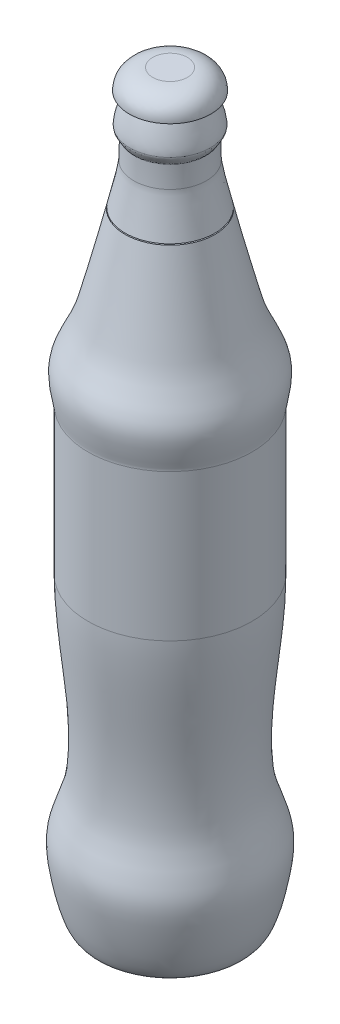
from build123d import *

# Parameters (mm, degrees)
ESBO_O4_R             = 12.021384461
CORTE_EXTRUS_O1_DEPTH = 0.1
ESBO_O5_R             = 0.5
CORTE_EXTRUS_O2_DEPTH = 0.4


with BuildPart() as part:
    # Esboço3 → Revolução1 (revolve)
    with BuildSketch(Plane.XY, mode=Mode.PRIVATE) as revolu_o1_sk:
        with BuildLine():
            Line((61.601817141, 32.402072085), (61.601817141, 47.838555424))
            add(Edge.make_bspline(
                [(61.601817141, 47.838555424), (61.601817141, 48.156811584), (60.859856314, 50.821300378), (61.77285658, 53.240312178), (62.783477222, 55.089658209), (63.874248839, 58.885612566), (66.369269293, 69.122641766), (66.419280732, 70.15583146)],
                knots=[0, 0, 0, 0, 0.186929837, 0.313357562, 0.493595799, 0.562260043, 1, 1, 1, 1], degree=3))
            add(Edge.make_bspline(
                [(66.476371283, 72.402019137), (66.476371283, 71.698138184), (66.457177975, 70.938753163), (66.419280732, 70.15583146)],
                knots=[0, 0, 0, 0, 0.075054494, 0.075054494, 0.075054494, 0.075054494], degree=3))
            add(Edge.make_bspline(
                [(65.999647343, 73.37030672), (65.999647343, 73.059092303), (66.476371283, 72.529263326), (66.476371283, 72.402019137)],
                knots=[0, 0, 0, 0, 1, 1, 1, 1], degree=3))
            add(Edge.make_bspline(
                [(65.999647343, 73.37030672), (65.999647343, 74.197074379), (66.839482035, 76.471404644)],
                knots=[0, 0, 0, 1, 1, 1], degree=2))
            Line((66.839482035, 76.471404644), (65.949262934, 76.471404644))
            add(Edge.make_bspline(
                [(68.409468023, 78.588337077), (67.155283918, 78.588337077), (65.949262934, 77.851984406), (65.949262934, 76.471404644)],
                knots=[0, 0, 0, 0, 1, 1, 1, 1], degree=3))
            Line((68.409468023, 78.588337077), (70.2369282, 78.588337077))
            Line((70.2369282, 78.588337077), (70.2369282, 0.72855248))
            Line((70.2369282, 0.72855248), (63.049496982, 0.72855248))
            add(Edge.make_bspline(
                [(63.049496982, 0.72855248), (62.280465322, 0.72855248), (61.19488738, 5.349373028), (60.838200592, 9.371029922), (62.333477371, 12.388067865), (63.179698711, 20.248645789), (61.601817141, 26.983300513), (61.601817141, 32.402072085)],
                knots=[0, 0, 0, 0, 0.184554254, 0.267801276, 0.401843949, 0.47532179, 1, 1, 1, 1], degree=3))
        make_face()
    revolve(revolu_o1_sk.sketch.rotate(Axis((70.2369282, 0.72855248, 0), (0, 1, 0)), 270), axis=Axis((70.2369282, 0.72855248, 0), (0, 1, 0)))

    # Esboço4 → Corte-extrusão1 (cut)
    with BuildSketch(Plane(origin=(0, 65.72855248, 0), x_dir=(-1, 0, 0), z_dir=(0, -1, 0))):
        with Locations((-70.2369282, 0)):
            Circle(ESBO_O4_R)
    extrude(amount=-CORTE_EXTRUS_O1_DEPTH, mode=Mode.SUBTRACT)


with BuildPart() as corte_extrus_o1_piece_1:
    # of the separate pieces the step leaves, piece 1, a body of its own (corte_extrus_o1_pieces)
    add(part.part.solids().sort_by_distance((70.2369282, 32.402072085, -8.63511106))[0])

    # Esboço5 → Corte-extrusão2 (cut)
    with BuildSketch(Plane.XZ.offset(-0.72855248)):
        with Locations(Location((70.2369282, 0, 0), (0, 0, 270))):
            Circle(ESBO_O5_R)
    extrude(amount=-CORTE_EXTRUS_O2_DEPTH, mode=Mode.SUBTRACT)


with BuildPart() as corte_extrus_o1_piece_2:
    # of the separate pieces the step leaves, piece 2, a body of its own (corte_extrus_o1_pieces)
    add(part.part.solids().sort_by_distance((70.2369282, 65.82855248, -4.717862276))[0])


solid = Compound([corte_extrus_o1_piece_1.part, corte_extrus_o1_piece_2.part])
